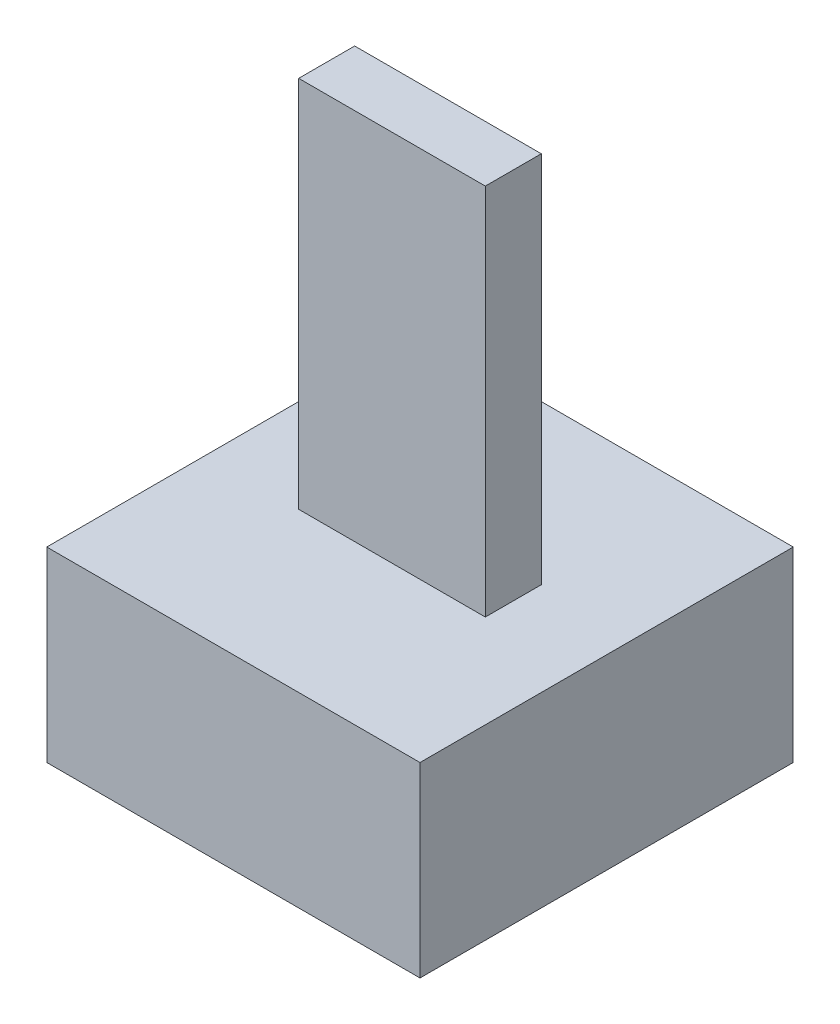
from build123d import *

# Parameters (mm, degrees)
SKETCH_1_W      = 10
SKETCH_1_H      = 10
EXTRUDE_1_DEPTH = 5
SKETCH_2_W      = 5
SKETCH_2_H      = 1.5
EXTRUDE_2_DEPTH = 10


with BuildPart() as part:
    # 草图1 → 凸台-拉伸1 (new body)
    with BuildSketch(Plane(origin=(0, 0, 0), x_dir=(1, 0, 0), z_dir=(0, 1, 0))):
        Rectangle(SKETCH_1_W, SKETCH_1_H)
    extrude(amount=EXTRUDE_1_DEPTH)

    # 草图2 → 凸台-拉伸2 (add)
    with BuildSketch(Plane(origin=(0, 5, 0), x_dir=(1, 0, 0), z_dir=(0, 1, 0))):
        Rectangle(SKETCH_2_W, SKETCH_2_H)
    extrude(amount=EXTRUDE_2_DEPTH)


solid = part.part
